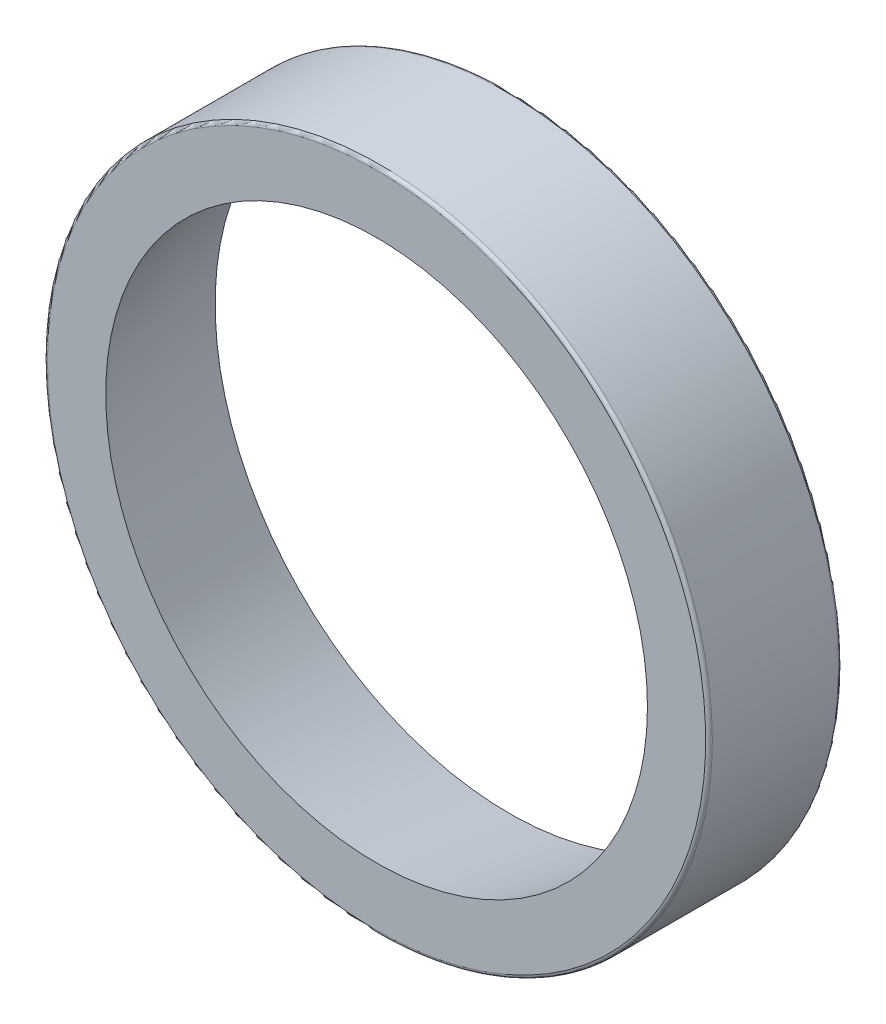
from build123d import *

# Parameters (mm, degrees)
FILLET1_R = 0.295275


with BuildPart() as part:
    # Sketch1 → Revolve1 (revolve)
    with BuildSketch(Plane(origin=(0, 0, 0), x_dir=(0, 0, -1), z_dir=(1, 0, 0))):
        Polygon((-8.334375, 29.5656), (3.476625, 29.5656), (3.476625, 26.171957969), (-8.334375, 24.08936), align=None)
    revolve(axis=Axis((0, 0, 8.334375), (0, 0, -1)))

    # Fillet1
    fillet1_edges = [part.edges().sort_by_distance(p)[0] for p in [
        (0, -29.5656, -3.476625),
        (0, -29.5656, 8.334375),
    ]]
    fillet(fillet1_edges, radius=FILLET1_R)


solid = part.part
